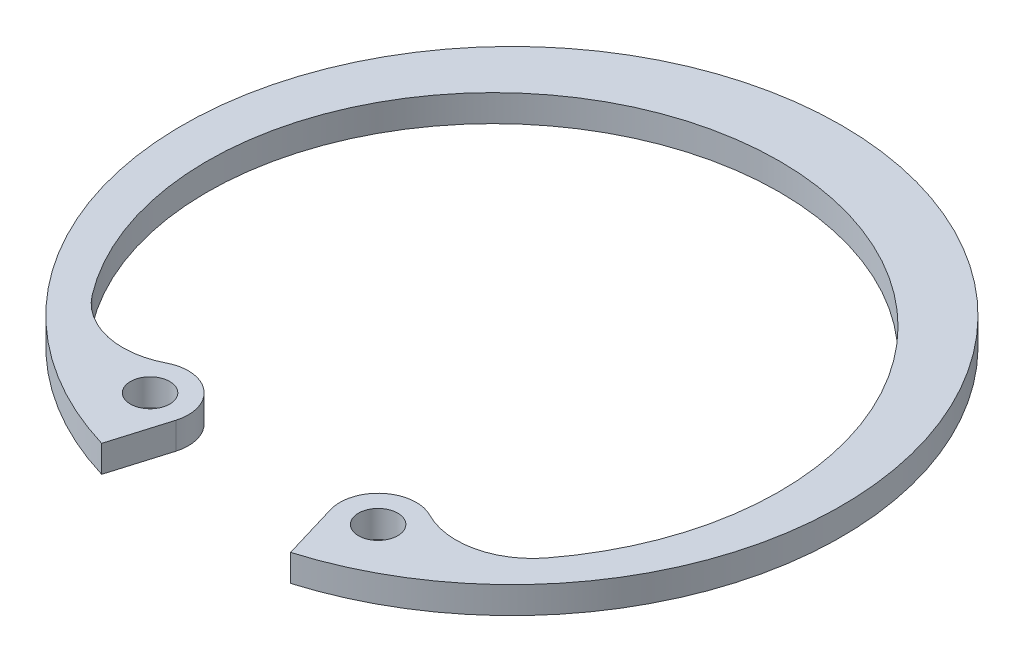
from build123d import *

# Parameters (mm, degrees)
SKETCH_1_R      = 0.95
EXTRUDE_1_DEPTH = 1.3


with BuildPart() as part:
    # 草图1 → 凸台-拉伸1 (new body)
    with BuildSketch(Plane(origin=(0, 0, 0), x_dir=(1, 0, 0), z_dir=(0, 1, 0))):
        with BuildLine():
            ThreePointArc((6.366785174, -10.348273625), (4.336586912, -10.567387921), (3.744794787, -12.521741558))
            Line((3.744794787, -12.521741558), (4.570066616, -15.281262746))
            ThreePointArc((4.570066616, -15.281262746), (0, 15.95), (-4.570066616, -15.281262746))
            Line((-4.570066616, -15.281262746), (-3.744794792, -12.521741574))
            ThreePointArc((-3.744794792, -12.521741574), (-4.336586905, -10.567387926), (-6.366785174, -10.348273625))
            ThreePointArc((-6.366785174, -10.348273625), (-8.87577758, -10.671754493), (-11.00617365, -9.30753481))
            ThreePointArc((-11.00617365, -9.30753481), (0, 12.95), (11.00617365, -9.30753481))
            ThreePointArc((11.00617365, -9.30753481), (8.87577758, -10.671754493), (6.366785174, -10.348273625))
        make_face()
        with Locations(Location((5.517229655, -11.991671149, 0), (0, 0, 270))):
            Circle(SKETCH_1_R, mode=Mode.SUBTRACT)
        with Locations(Location((-5.517229655, -11.991671149, 0), (0, 0, 270))):
            Circle(SKETCH_1_R, mode=Mode.SUBTRACT)
    extrude(amount=EXTRUDE_1_DEPTH)


solid = part.part
